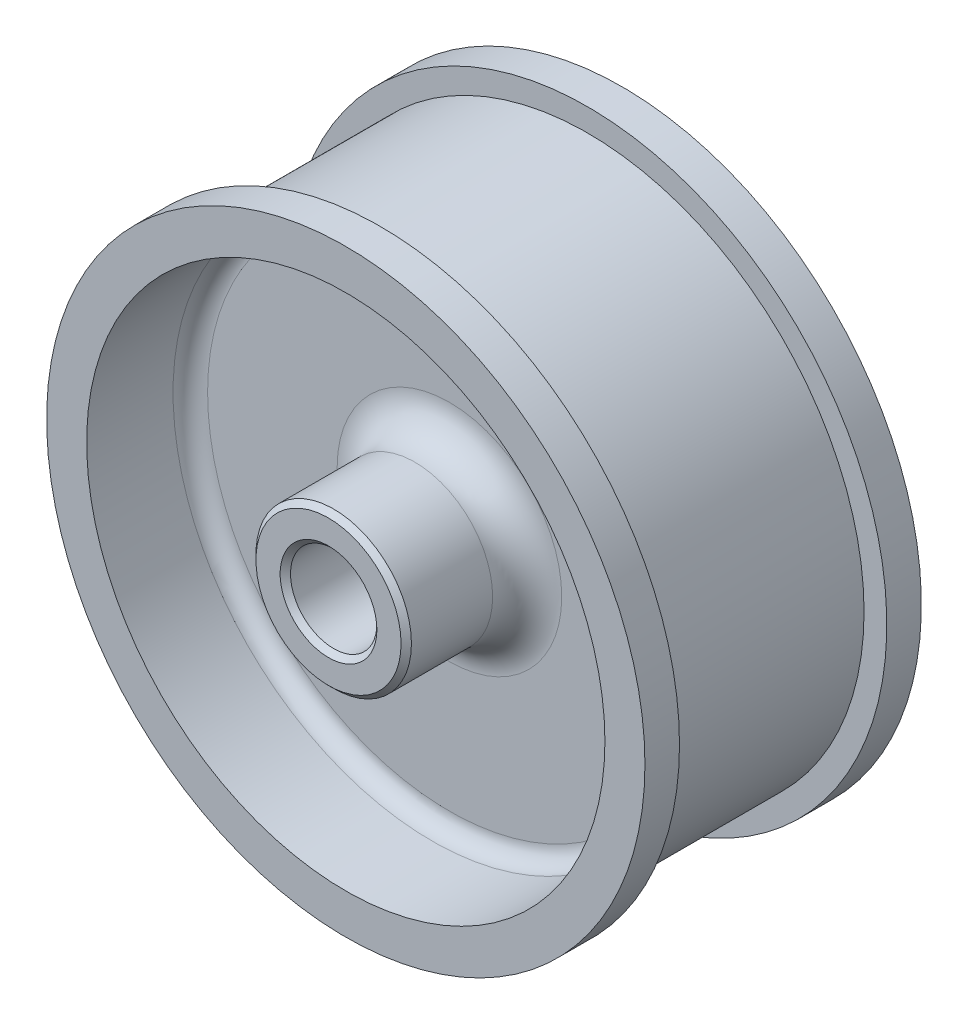
from build123d import *

# Parameters (mm, degrees)
SKETCH1_R           = 2.25
SKETCH1_R_2         = 1.25
BOSS_EXTRUDE1_DEPTH = 4.5
SKETCH2_R           = 7.650801396
SKETCH2_R_2         = 2.25
BOSS_EXTRUDE2_DEPTH = 1
FILLET2_R           = 1
FILLET3_R           = 1
SKETCH3_R           = 8
SKETCH3_R_2         = 7.5
BOSS_EXTRUDE3_DEPTH = 3
FILLET4_R           = 0.5
SKETCH4_R           = 8.658348899
SKETCH4_R_2         = 7.5
BOSS_EXTRUDE4_DEPTH = 1
BOSS_EXTRUDE5_START = 1
SKETCH5_R           = 8.658348899
SKETCH5_R_2         = 7.5
BOSS_EXTRUDE5_DEPTH = 1
CHAMFER1_SIZE       = 0.15


with BuildPart() as part:
    # Sketch1 → Boss-Extrude1 (new, symmetric)
    with BuildSketch(Plane.XY):
        Circle(SKETCH1_R)
        Circle(SKETCH1_R_2, mode=Mode.SUBTRACT)
    extrude(amount=BOSS_EXTRUDE1_DEPTH, both=True)

    # Sketch2 → Boss-Extrude2 (add, symmetric)
    with BuildSketch(Plane.XY):
        Circle(SKETCH2_R)
        Circle(SKETCH2_R_2, mode=Mode.SUBTRACT)
    extrude(amount=BOSS_EXTRUDE2_DEPTH, both=True)

    # Fillet2
    fillet2_edges = [part.edges().sort_by_distance(p)[0] for p in [
        (-2.25, 0, 1),
    ]]
    fillet(fillet2_edges, radius=FILLET2_R)

    # Fillet3
    fillet3_edges = [part.edges().sort_by_distance(p)[0] for p in [
        (-2.25, 0, -1),
    ]]
    fillet(fillet3_edges, radius=FILLET3_R)

    # Sketch3 → Boss-Extrude3 (add, symmetric)
    with BuildSketch(Plane.XY):
        Circle(SKETCH3_R)
        Circle(SKETCH3_R_2, mode=Mode.SUBTRACT)
    extrude(amount=BOSS_EXTRUDE3_DEPTH, both=True)

    # Fillet4
    fillet4_edges = [part.edges().sort_by_distance(p)[0] for p in [
        (-7.5, 0, 1),
        (-7.5, 0, -1),
    ]]
    fillet(fillet4_edges, radius=FILLET4_R)

    # Sketch4 → Boss-Extrude4 (add)
    with BuildSketch(Plane.XY.offset(3)):
        Circle(SKETCH4_R)
        Circle(SKETCH4_R_2, mode=Mode.SUBTRACT)
    extrude(amount=BOSS_EXTRUDE4_DEPTH)

    # Sketch5 → Boss-Extrude5 (add)
    with BuildSketch(Plane(origin=(0, 0, -3), x_dir=(-1, 0, 0), z_dir=(0, 0, -1)).offset(BOSS_EXTRUDE5_START)):
        with Locations(Location((0, 0, 0), (0, 0, 180))):
            Circle(SKETCH5_R)
        Circle(SKETCH5_R_2, mode=Mode.SUBTRACT)
    extrude(amount=-BOSS_EXTRUDE5_DEPTH)

    # Chamfer1
    chamfer1_edges = [part.edges().sort_by_distance(p)[0] for p in [
        (-2.25, 0, -4.5),
        (-2.25, 0, 4.5),
        (-1.25, 0, -4.5),
        (-1.25, 0, 4.5),
    ]]
    chamfer(chamfer1_edges, length=CHAMFER1_SIZE)


solid = part.part
